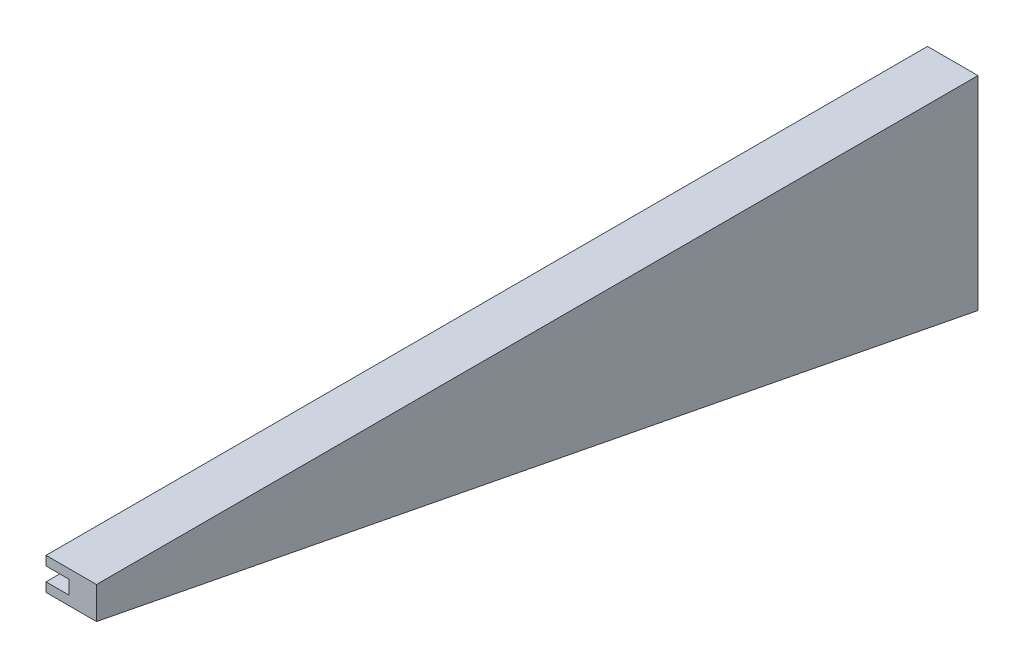
from build123d import *

# Parameters (mm, degrees)
SKETCH1_W           = 8
SKETCH1_H           = 7
BOSS_EXTRUDE1_DEPTH = 192
SKETCH2_W           = 5
SKETCH2_H           = 3
CUT_EXTRUDE1_DEPTH  = 192
BOSS_EXTRUDE2_DEPTH = 3


with BuildPart() as part:
    # Sketch1 → Boss-Extrude1 (new body)
    with BuildSketch(Plane.XY):
        Rectangle(SKETCH1_W, SKETCH1_H)
    extrude(amount=BOSS_EXTRUDE1_DEPTH)

    # Sketch2 → Cut-Extrude1 (cut)
    with BuildSketch(Plane.XY.offset(192)):
        with Locations((-1.5, 0)):
            Rectangle(SKETCH2_W, SKETCH2_H)
    extrude(amount=-CUT_EXTRUDE1_DEPTH, mode=Mode.SUBTRACT)

    # Sketch3 → Boss-Extrude2 (add)
    with BuildSketch(Plane(origin=(4, 0, 0), x_dir=(0, 0, -1), z_dir=(1, 0, 0))):
        Polygon((-192, -3.5), (0, -40.821019354), (0, -3.5), (0, 3.5), (-192, 3.5), align=None)
    extrude(amount=BOSS_EXTRUDE2_DEPTH)


solid = part.part
